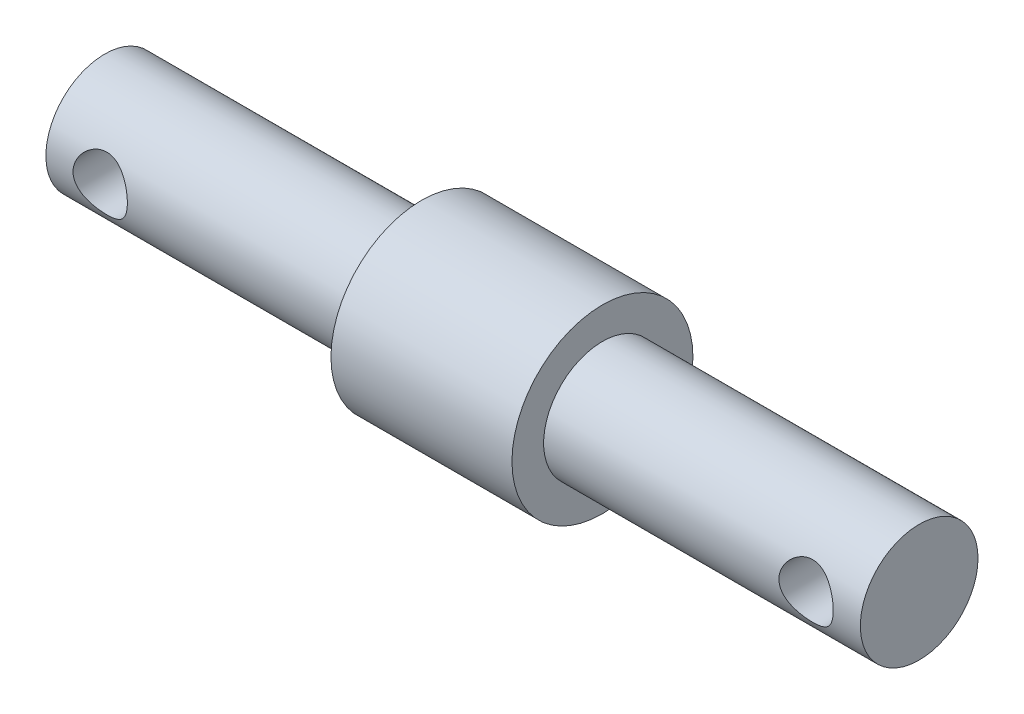
from build123d import *

# Parameters (mm, degrees)
SKETCH1_R           = 3.25
BOSS_EXTRUDE1_DEPTH = 22.5
SKETCH2_R           = 1.5
CUT_EXTRUDE1_DEPTH  = 15
SKETCH3_R           = 5
BOSS_EXTRUDE2_DEPTH = 5


with BuildPart() as part:
    # Sketch1 → Boss-Extrude1 (new, symmetric)
    with BuildSketch(Plane(origin=(0, 0, 0), x_dir=(0, 0, -1), z_dir=(1, 0, 0))):
        with Locations(Location((0, 0, 0), (0, 0, 180))):
            Circle(SKETCH1_R)
    extrude(amount=BOSS_EXTRUDE1_DEPTH, both=True)

    # Sketch2 → Cut-Extrude1 (cut, symmetric)
    with BuildSketch(Plane.XY):
        with Locations((-19.5, 0)):
            Circle(SKETCH2_R)
        with Locations((19.5, 0)):
            Circle(SKETCH2_R)
    extrude(amount=CUT_EXTRUDE1_DEPTH, both=True, mode=Mode.SUBTRACT)

    # Sketch3 → Boss-Extrude2 (add, symmetric)
    with BuildSketch(Plane(origin=(0, 0, 0), x_dir=(0, 0, -1), z_dir=(1, 0, 0))):
        Circle(SKETCH3_R)
    extrude(amount=BOSS_EXTRUDE2_DEPTH, both=True)


solid = part.part
